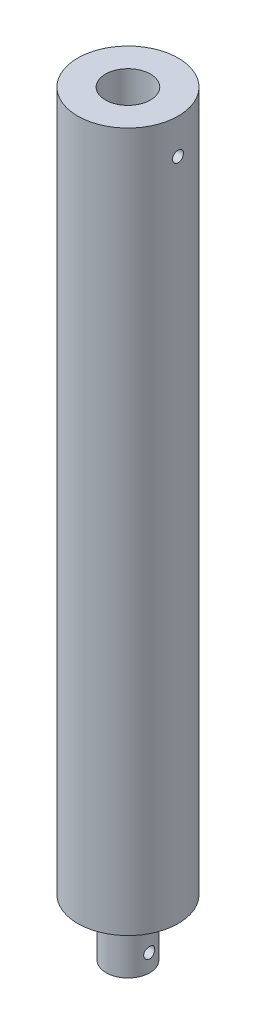
from build123d import *

# Parameters (mm, degrees)
SKETCH1_R           = 6.35
BOSS_EXTRUDE1_DEPTH = 19.05
SKETCH2_R           = 1.5875
CUT_EXTRUDE1_DEPTH  = 25.4
SKETCH4_R           = 14.605
SKETCH4_R_2         = 6.35
BOSS_EXTRUDE3_DEPTH = 203.2
SKETCH5_R           = 1.5875
CUT_EXTRUDE2_DEPTH  = 63.5
SKETCH6_R           = 6.5405
CUT_EXTRUDE3_DEPTH  = 12.7


with BuildPart() as part:
    # Sketch1 → Boss-Extrude1 (new body)
    with BuildSketch(Plane(origin=(0, 0, 0), x_dir=(1, 0, 0), z_dir=(0, 1, 0))):
        with Locations(Location((0, 0, 0), (0, 0, 90))):
            Circle(SKETCH1_R)
    extrude(amount=BOSS_EXTRUDE1_DEPTH)

    # Sketch2 → Cut-Extrude1 (cut, symmetric)
    with BuildSketch(Plane(origin=(0, 0, 0), x_dir=(0, 0, -1), z_dir=(1, 0, 0))):
        with Locations((0, 5.08)):
            Circle(SKETCH2_R)
    extrude(amount=CUT_EXTRUDE1_DEPTH, both=True, mode=Mode.SUBTRACT)


with BuildPart() as body_2:
    # Sketch4 → Boss-Extrude3 (new body)
    with BuildSketch(Plane(origin=(0, 16.51, 0), x_dir=(1, 0, 0), z_dir=(0, 1, 0))):
        with Locations(Location((0, 0, 0), (0, 0, 270))):
            Circle(SKETCH4_R)
        with Locations(Location((0, 0, 0), (0, 0, 270))):
            Circle(SKETCH4_R_2, mode=Mode.SUBTRACT)
    extrude(amount=BOSS_EXTRUDE3_DEPTH)

    # Sketch5 → Cut-Extrude2 (cut, symmetric)
    with BuildSketch(Plane(origin=(0, 0, 0), x_dir=(0, 0, -1), z_dir=(1, 0, 0))):
        with Locations((0, 209.55)):
            Circle(SKETCH5_R)
    extrude(amount=CUT_EXTRUDE2_DEPTH, both=True, mode=Mode.SUBTRACT)

    # Sketch6 → Cut-Extrude3 (cut, symmetric)
    with BuildSketch(Plane(origin=(0, 219.71, 0), x_dir=(1, 0, 0), z_dir=(0, 1, 0))):
        with Locations(Location((0, 0, 0), (0, 0, 270))):
            Circle(SKETCH6_R)
    extrude(amount=CUT_EXTRUDE3_DEPTH, both=True, mode=Mode.SUBTRACT)


solid = Compound([part.part, body_2.part])
